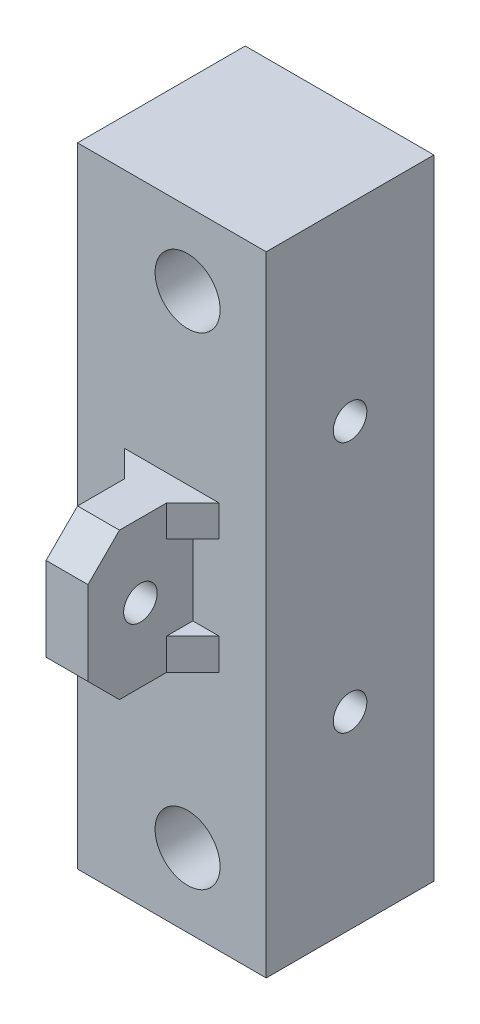
from build123d import *

# Parameters (mm, degrees)
SKETCH1_W           = 18
SKETCH1_H           = 60
BOSS_EXTRUDE1_DEPTH = 16
SKETCH2_R           = 3.1
CUT_EXTRUDE1_DEPTH  = 36.17101079
SKETCH3_R           = 1.6
CUT_EXTRUDE2_DEPTH  = 39.470768123
SKETCH4_W           = 4
SKETCH4_H           = 14
BOSS_EXTRUDE2_DEPTH = 10
SKETCH5_R           = 1.6
CUT_EXTRUDE3_DEPTH  = 10
CHAMFER1_SIZE       = 3
BOSS_EXTRUDE3_DEPTH = 3
BOSS_EXTRUDE4_DEPTH = 3


with BuildPart() as part:
    # Sketch1 → Boss-Extrude1 (new body)
    with BuildSketch(Plane.XY):
        Rectangle(SKETCH1_W, SKETCH1_H)
    extrude(amount=BOSS_EXTRUDE1_DEPTH)

    # Sketch2 → Cut-Extrude1 (cut, through all)
    with BuildSketch(Plane.XY.offset(16)):
        with Locations((1.5, 23)):
            Circle(SKETCH2_R)
        with Locations((1.5, -23)):
            Circle(SKETCH2_R)
    extrude(amount=-CUT_EXTRUDE1_DEPTH, mode=Mode.SUBTRACT)

    # Sketch3 → Cut-Extrude2 (cut, through all)
    with BuildSketch(Plane(origin=(9, 0, 0), x_dir=(0, 0, -1), z_dir=(1, 0, 0))):
        with Locations(Location((-8, 12, 0), (0, 0, 90))):
            Circle(SKETCH3_R)
        with Locations(Location((-8, -12, 0), (0, 0, 90))):
            Circle(SKETCH3_R)
    extrude(amount=-CUT_EXTRUDE2_DEPTH, mode=Mode.SUBTRACT)

    # Sketch4 → Boss-Extrude2 (add)
    with BuildSketch(Plane.XY.offset(16)):
        Rectangle(SKETCH4_W, SKETCH4_H)
    extrude(amount=BOSS_EXTRUDE2_DEPTH)

    # Sketch5 → Cut-Extrude3 (cut)
    with BuildSketch(Plane(origin=(2, 0, 0), x_dir=(0, 0, -1), z_dir=(1, 0, 0))):
        with Locations(Location((-21, 0, 0), (0, 0, 90))):
            Circle(SKETCH5_R)
    extrude(amount=-CUT_EXTRUDE3_DEPTH, mode=Mode.SUBTRACT)

    # Chamfer1
    chamfer1_edges = [part.edges().sort_by_distance(p)[0] for p in [
        (0, 7, 26),
        (0, -7, 26),
    ]]
    chamfer(chamfer1_edges, length=CHAMFER1_SIZE)

    # Sketch6 → Boss-Extrude3 (add)
    with BuildSketch(Plane(origin=(0, 7, 0), x_dir=(1, 0, 0), z_dir=(0, 1, 0))):
        Polygon((2, -16), (4.5, -16), (2, -18.5), align=None)
        Polygon((-4.5, -16), (-2, -18.5), (-2, -16), align=None)
    extrude(amount=-BOSS_EXTRUDE3_DEPTH)

    # Sketch7 → Boss-Extrude4 (add)
    with BuildSketch(Plane.XZ.offset(7)):
        Polygon((-2, 16), (-2, 18.5), (-4.5, 16), align=None)
        Polygon((2, 16), (2, 18.5), (4.5, 16), align=None)
    extrude(amount=-BOSS_EXTRUDE4_DEPTH)


solid = part.part
